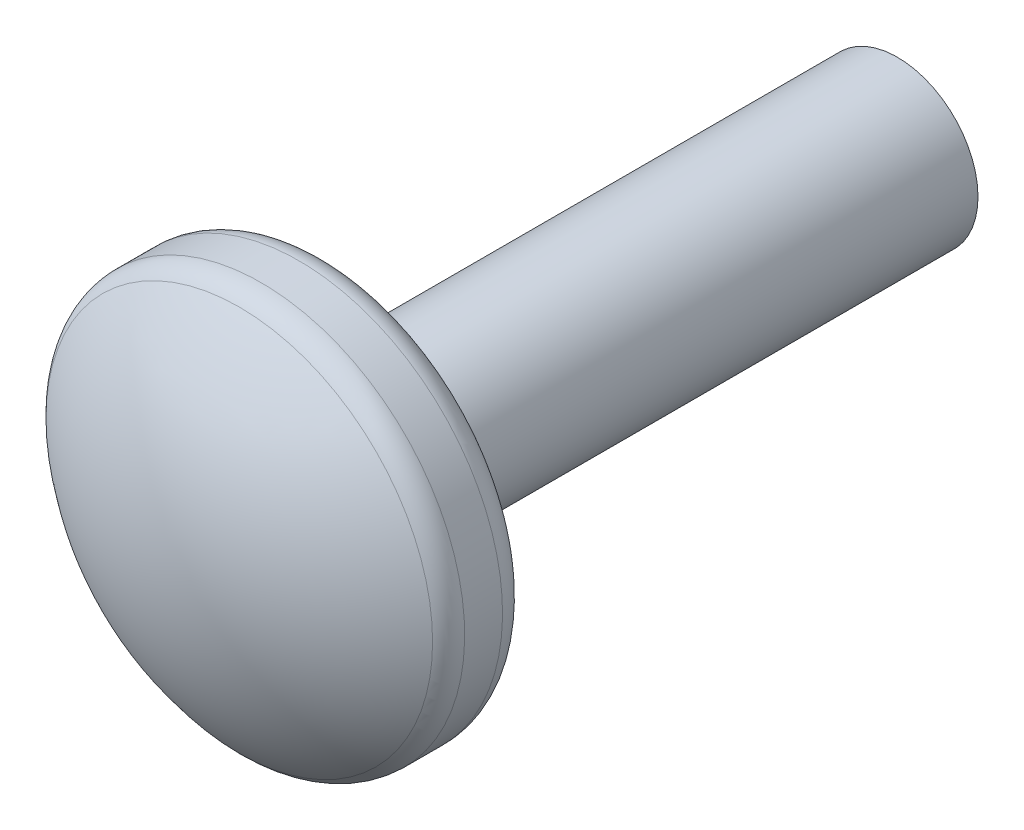
from build123d import *

# Parameters (mm, degrees)
SKETCH3_W = 14
SKETCH3_H = 1.980384758
SKETCH8_W = 3.9
SKETCH8_H = 5


with BuildPart() as part:
    # Sketch3 → Revolve1 (revolve)
    with BuildSketch(Plane(origin=(0, 0, 0), x_dir=(0, 0, -1), z_dir=(1, 0, 0)), mode=Mode.PRIVATE) as revolve1_sk:
        with Locations((-7, 0.990192379)):
            Rectangle(SKETCH3_W, SKETCH3_H)
    revolve(revolve1_sk.sketch.rotate(Axis((0, 0, 0), (0, 0, -1)), 90), axis=Axis((0, 0, 0), (0, 0, -1)))

    # Sketch8 → Revolve2 (revolve)
    with BuildSketch(Plane(origin=(0, 0, 0), x_dir=(0, 0, -1), z_dir=(1, 0, 0)), mode=Mode.PRIVATE) as revolve2_sk:
        with Locations((-15.95, 2.5)):
            Rectangle(SKETCH8_W, SKETCH8_H)
    revolve(revolve2_sk.sketch.rotate(Axis((0, 0, 0), (0, 0, 1)), 90), axis=Axis((0, 0, 0), (0, 0, 1)))

    # Sketch11 → Cut-Revolve3 (revolve, cut)
    with BuildSketch(Plane(origin=(0, 0, 0), x_dir=(0, 0, -1), z_dir=(1, 0, 0)), mode=Mode.PRIVATE) as cut_revolve3_sk:
        with BuildLine():
            Line((-15.632664285, 5), (-14.702, 5))
            ThreePointArc((-14.702, 5), (-14.20561104, 4.79438896), (-14, 4.298))
            Line((-14, 4.298), (-13.365, 4.298))
            Line((-13.365, 4.298), (-13.365, 5.635))
            Line((-13.365, 5.635), (-18.535, 5.635))
            Line((-18.535, 5.635), (-18.535, 0))
            Line((-18.535, 0), (-17.9, 0))
            ThreePointArc((-17.9, 0), (-17.454099823, 2.527320184), (-16.170243589, 4.749455969))
            ThreePointArc((-16.170243589, 4.749455969), (-15.929212687, 4.934288492), (-15.632664285, 5))
        make_face()
    revolve(cut_revolve3_sk.sketch.rotate(Axis((0, 0, 17.9), (0, 0, -1)), 180), axis=Axis((0, 0, 17.9), (0, 0, -1)), mode=Mode.SUBTRACT)


solid = part.part
